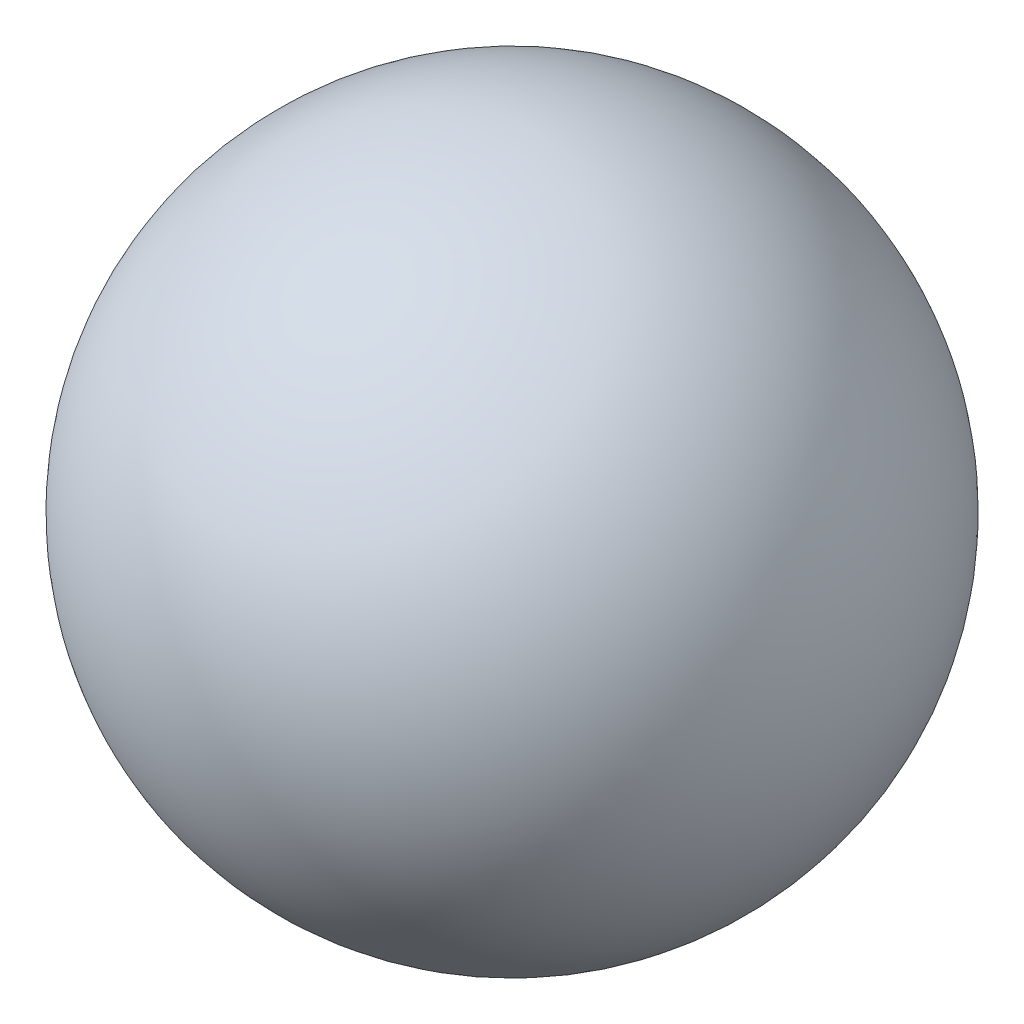
from build123d import *


with BuildPart() as part:
    # Esboço1 → Revolução1 (revolve)
    with BuildSketch(Plane(origin=(0, 0, 0), x_dir=(1, 0, 0), z_dir=(0, 1, 0))):
        with BuildLine():
            Line((0, -0.7375), (0, -10.2625))
            ThreePointArc((0, -10.2625), (4.7625, -5.5), (0, -0.7375))
        make_face()
    revolve(axis=Axis((0, 0, 0.7375), (0, 0, 1)))


solid = part.part
